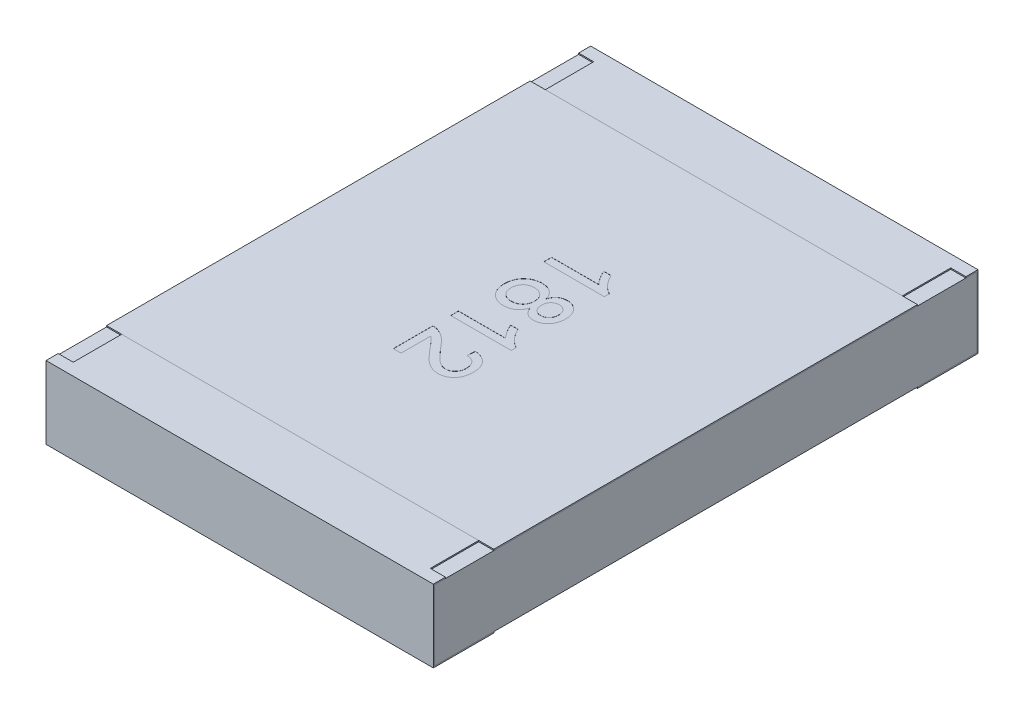
from build123d import *

# Parameters (mm, degrees)
BOSS_EXTRUDE2_DEPTH   = 1.6
BOSS_EXTRUDE2_2_DEPTH = 1.6
BOSS_EXTRUDE3_START   = -1.6
SKETCH5_W             = 4.48
SKETCH5_H             = 0.58
BOSS_EXTRUDE3_DEPTH   = 3.2
SKETCH6_W             = 0.125
SKETCH6_H             = 0.4
CUT_EXTRUDE1_DEPTH    = 0.01
SKETCH7_W             = 3.2
SKETCH7_H             = 3.5
BOSS_EXTRUDE4_DEPTH   = 0.01
TEXT1812_DEPTH        = 0.001


with BuildPart() as part:
    # Sketch4 → Boss-Extrude2 (new, symmetric)
    with BuildSketch(Plane(origin=(0, 0, 0), x_dir=(0, 0, -1), z_dir=(1, 0, 0))):
        Polygon((-2.25, 0.3), (-2.25, -0.3), (-1.75, -0.3), (-1.75, -0.29), (-2.24, -0.29), (-2.24, 0.29), (-1.75, 0.29), (-1.75, 0.3), align=None)
    extrude(amount=BOSS_EXTRUDE2_DEPTH, both=True)


with BuildPart() as body_2:
    # Sketch4 → Boss-Extrude2 2 (new, symmetric)
    with BuildSketch(Plane(origin=(0, 0, 0), x_dir=(0, 0, -1), z_dir=(1, 0, 0))):
        Polygon((1.75, 0.3), (2.25, 0.3), (2.25, -0.3), (1.75, -0.3), (1.75, -0.29), (2.24, -0.29), (2.24, 0.29), (1.75, 0.29), align=None)
    extrude(amount=BOSS_EXTRUDE2_2_DEPTH, both=True)


with BuildPart() as body_3:
    # Sketch5 → Boss-Extrude3 (new body)
    with BuildSketch(Plane(origin=(0, 0, 0), x_dir=(0, 0, -1), z_dir=(1, 0, 0)).offset(BOSS_EXTRUDE3_START)):
        Rectangle(SKETCH5_W, SKETCH5_H)
    extrude(amount=BOSS_EXTRUDE3_DEPTH)


with BuildPart() as cut_extrude1_tool:
    # Sketch6 → Cut-Extrude1 (new body)
    with BuildSketch(Plane(origin=(0, 0.3, 0), x_dir=(1, 0, 0), z_dir=(0, 1, 0))):
        with Locations((-1.5375, 1.95)):
            Rectangle(SKETCH6_W, SKETCH6_H)
        with Locations((1.5375, 1.95)):
            Rectangle(SKETCH6_W, SKETCH6_H)
        with Locations((1.5375, -1.95)):
            Rectangle(SKETCH6_W, SKETCH6_H)
        with Locations((-1.5375, -1.95)):
            Rectangle(SKETCH6_W, SKETCH6_H)
    extrude(amount=-CUT_EXTRUDE1_DEPTH)


with BuildPart() as part_1:
    add(part.part)

    # Cut-Extrude1: cut by cut_extrude1_tool
    add(cut_extrude1_tool.part, mode=Mode.SUBTRACT)


with BuildPart() as body_2_1:
    add(body_2.part)

    # Cut-Extrude1: cut by cut_extrude1_tool
    add(cut_extrude1_tool.part, mode=Mode.SUBTRACT)


with BuildPart() as body_4:
    # Sketch7 → Boss-Extrude4 (new body)
    with BuildSketch(Plane(origin=(0, 0.29, 0), x_dir=(1, 0, 0), z_dir=(0, 1, 0))):
        Rectangle(SKETCH7_W, SKETCH7_H)
    extrude(amount=BOSS_EXTRUDE4_DEPTH)

    # Sketch14 → TEXT1812 (cut)
    # profile 1 of 4: a face of its own
    with BuildSketch(Plane(origin=(0, 0.3, 0), x_dir=(1, 0, 0), z_dir=(0, 1, 0))):
        with BuildLine():
            Line((-0.25, 0.512820513), (-0.25, 0.576923077))
            Line((-0.25, 0.576923077), (0.139623397, 0.576923077))
            add(Edge.make_bspline(
                [(0.139623397, 0.576923077), (0.136064182, 0.58061432), (0.128666742, 0.588286164), (0.118190939, 0.601250264), (0.107619408, 0.615716685), (0.097315673, 0.631445442), (0.08780582, 0.647602006), (0.079128194, 0.663167946), (0.071822591, 0.677925848), (0.067824115, 0.6876443), (0.065905449, 0.692307692)],
                knots=[0, 0, 0, 0, 0.89334793, 1.85672577, 2.901900665, 4.015525414, 5.132247281, 6.168817625, 7.121308293, 8, 8, 8, 8], degree=3))
            Line((0.065905449, 0.692307692), (0.125, 0.692307692))
            add(Edge.make_bspline(
                [(0.125, 0.692307692), (0.129125269, 0.684297492), (0.137255931, 0.668509861), (0.151298701, 0.646205353), (0.166521642, 0.625381695), (0.182921383, 0.606383602), (0.199684862, 0.589353021), (0.216599871, 0.575001104), (0.233046379, 0.562992333), (0.244515995, 0.556967305), (0.25, 0.554086538)],
                knots=[0, 0, 0, 0, 1.141258006, 2.249351951, 3.335817539, 4.406819942, 5.426913362, 6.360259544, 7.215985427, 8, 8, 8, 8], degree=3))
            Line((0.25, 0.554086538), (0.25, 0.512820513))
            Line((0.25, 0.512820513), (-0.25, 0.512820513))
        make_face()
    # profile 2 of 4: a face of its own
    with BuildSketch(Plane(origin=(0, 0.3, 0), x_dir=(1, 0, 0), z_dir=(0, 1, 0))):
        with BuildLine():
            add(Edge.make_bspline(
                [(0.024238782, 0.257612179), (0.02539818, 0.260734707), (0.027670824, 0.266855463), (0.031729797, 0.27555031), (0.035977971, 0.283700759), (0.040722444, 0.291157678), (0.045841435, 0.297963565), (0.05125653, 0.30423121), (0.057051297, 0.309834993), (0.065251162, 0.316419757), (0.076469857, 0.323183919), (0.091129194, 0.329224351), (0.107150389, 0.33263727), (0.118206708, 0.333096786), (0.123898237, 0.333333333)],
                knots=[0, 0, 0, 0, 0.890222809, 1.74500863, 2.563651195, 3.346212301, 4.104991207, 4.83894661, 5.558649094, 6.25711142, 7.647231111, 9.044669077, 10.478666118, 12, 12, 12, 12], degree=3))
            add(Edge.make_bspline(
                [(0.123898237, 0.333333333), (0.128278386, 0.33322309), (0.136876757, 0.33300668), (0.149495643, 0.331144582), (0.161579073, 0.328143532), (0.17314744, 0.323945425), (0.184113889, 0.318454597), (0.194640222, 0.311930016), (0.204558084, 0.304074883), (0.213797595, 0.295071423), (0.22236411, 0.28520001), (0.229759149, 0.274364923), (0.236018114, 0.262741386), (0.241127177, 0.25035236), (0.245166426, 0.237181397), (0.247909652, 0.223181874), (0.249656619, 0.208410812), (0.249883757, 0.198289026), (0.25, 0.193108974)],
                knots=[0, 0, 0, 0, 0.994240253, 1.951724694, 2.889525738, 3.817746603, 4.740003333, 5.669832901, 6.625394318, 7.606598607, 8.595883349, 9.588474514, 10.579007712, 11.588538026, 12.627005715, 13.70202693, 14.823960705, 16, 16, 16, 16], degree=3))
            add(Edge.make_bspline(
                [(0.25, 0.193108974), (0.249882531, 0.187895942), (0.249653714, 0.177741542), (0.247930845, 0.162891635), (0.245043208, 0.14880509), (0.240946379, 0.135490203), (0.235708336, 0.122925982), (0.229270093, 0.111194985), (0.221737839, 0.10017645), (0.213021747, 0.090152007), (0.203558906, 0.081030959), (0.193421, 0.073128432), (0.18284459, 0.066350686), (0.171765423, 0.060749897), (0.160057336, 0.056606413), (0.147940915, 0.053448147), (0.135272194, 0.051616207), (0.126675148, 0.051394826), (0.122295673, 0.051282051)],
                knots=[0, 0, 0, 0, 1.171211919, 2.281388661, 3.353996503, 4.398126828, 5.406889753, 6.407389155, 7.400009931, 8.40008733, 9.387021643, 10.349004252, 11.283445052, 12.206096336, 13.131640667, 14.068727932, 15.016178647, 16, 16, 16, 16], degree=3))
            add(Edge.make_bspline(
                [(0.122295673, 0.051282051), (0.116799676, 0.051466005), (0.10602306, 0.051826703), (0.090480034, 0.055476664), (0.076018484, 0.061214569), (0.062720931, 0.069312308), (0.050803482, 0.079893012), (0.040306374, 0.092829954), (0.031199936, 0.108119802), (0.026621629, 0.119485302), (0.024238782, 0.125400641)],
                knots=[0, 0, 0, 0, 0.998577706, 1.958023041, 2.887613884, 3.820138197, 4.775709617, 5.772955836, 6.84090252, 8, 8, 8, 8], degree=3))
            add(Edge.make_bspline(
                [(0.024238782, 0.125400641), (0.022972264, 0.121667525), (0.020490437, 0.114352236), (0.015654785, 0.104016949), (0.010491973, 0.094287259), (0.004755578, 0.085171654), (-0.001623653, 0.076801098), (-0.008616028, 0.069117804), (-0.016120459, 0.062074287), (-0.024261073, 0.055779607), (-0.032853908, 0.050153458), (-0.041930308, 0.045354732), (-0.051322704, 0.041218919), (-0.061196276, 0.037924547), (-0.071409343, 0.035168652), (-0.082118687, 0.033438089), (-0.093157345, 0.032290042), (-0.100658015, 0.032131696), (-0.104467147, 0.032051282)],
                knots=[0, 0, 0, 0, 1.104291852, 2.163932927, 3.194021359, 4.191095491, 5.179477954, 6.14022076, 7.100416342, 8.060839972, 9.021354806, 9.976015018, 10.935845611, 11.894808797, 12.891399605, 13.897699827, 14.932370222, 16, 16, 16, 16], degree=3))
            add(Edge.make_bspline(
                [(-0.104467147, 0.032051282), (-0.109716763, 0.032178662), (-0.120058905, 0.032429611), (-0.135239829, 0.034634842), (-0.149823668, 0.037970706), (-0.163746516, 0.042837484), (-0.177026708, 0.04904393), (-0.189596023, 0.056746767), (-0.201582432, 0.065712197), (-0.212864831, 0.075939819), (-0.222998595, 0.087444582), (-0.232020834, 0.099798024), (-0.239541591, 0.113135515), (-0.245775203, 0.127285349), (-0.25060455, 0.142323412), (-0.253986549, 0.15822815), (-0.256000272, 0.174994886), (-0.256271764, 0.186459437), (-0.256410256, 0.192307692)],
                knots=[0, 0, 0, 0, 1.017538442, 2.004628281, 2.968924565, 3.91494067, 4.859182549, 5.806372248, 6.768514164, 7.758487756, 8.75376163, 9.736765884, 10.719748815, 11.717042441, 12.730597361, 13.777018535, 14.866020668, 16, 16, 16, 16], degree=3))
            add(Edge.make_bspline(
                [(-0.256410256, 0.192307692), (-0.256268784, 0.198155367), (-0.255991451, 0.209618779), (-0.254018827, 0.226400775), (-0.250483765, 0.242282968), (-0.24564863, 0.257300724), (-0.239586942, 0.27153775), (-0.23188486, 0.284775617), (-0.22294704, 0.297207024), (-0.212624421, 0.308545577), (-0.201347774, 0.318828416), (-0.189308416, 0.327910716), (-0.176534929, 0.335534366), (-0.163096374, 0.34182974), (-0.148943574, 0.346620754), (-0.134138206, 0.349985066), (-0.118689254, 0.352193996), (-0.108147498, 0.352438995), (-0.102764423, 0.352564103)],
                knots=[0, 0, 0, 0, 1.127132101, 2.209558585, 3.251034113, 4.258468952, 5.24716777, 6.227410442, 7.204479088, 8.19324074, 9.17723664, 10.142577905, 11.095069694, 12.039439042, 12.9979991, 13.969008511, 14.962888173, 16, 16, 16, 16], degree=3))
            add(Edge.make_bspline(
                [(-0.102764423, 0.352564103), (-0.098756291, 0.35247721), (-0.090891642, 0.352306713), (-0.079356793, 0.351263651), (-0.068361168, 0.349189532), (-0.057847876, 0.346503218), (-0.047749211, 0.343140941), (-0.03826149, 0.338800508), (-0.029246667, 0.333745833), (-0.020751206, 0.327965366), (-0.012849932, 0.321418629), (-0.005462304, 0.314322793), (0.001111121, 0.30643177), (0.007217111, 0.298045895), (0.012370618, 0.288792182), (0.017102053, 0.27902539), (0.021136528, 0.268574639), (0.023194341, 0.261302929), (0.024238782, 0.257612179)],
                knots=[0, 0, 0, 0, 1.117534471, 2.192795984, 3.224263148, 4.233356591, 5.216445495, 6.187029668, 7.137182002, 8.094962556, 9.047164155, 9.994988631, 10.946006748, 11.906812617, 12.882337995, 13.893960874, 14.931081791, 16, 16, 16, 16], degree=3))
        make_face()
        with BuildLine():
            add(Edge.make_bspline(
                [(0.123597756, 0.269230769), (0.120991462, 0.269173094), (0.115896151, 0.269060339), (0.108439177, 0.268178174), (0.101377018, 0.266534271), (0.094654968, 0.264359918), (0.088296098, 0.261507996), (0.082239417, 0.258129834), (0.07663087, 0.253979684), (0.071437279, 0.249278184), (0.066668381, 0.244061347), (0.062556899, 0.238195666), (0.059025979, 0.231791872), (0.056288833, 0.224789943), (0.053861642, 0.217368853), (0.05250548, 0.209270002), (0.051402828, 0.200684498), (0.05132298, 0.194749107), (0.051282051, 0.191706731)],
                knots=[0, 0, 0, 0, 1.043049103, 2.039163835, 2.998665249, 3.940985218, 4.862225824, 5.783757118, 6.711179319, 7.64779742, 8.584415522, 9.533532517, 10.508265797, 11.503304424, 12.538793855, 13.626426179, 14.783347844, 16, 16, 16, 16], degree=3))
            add(Edge.make_bspline(
                [(0.051282051, 0.191706731), (0.051324337, 0.188731441), (0.051406793, 0.182929788), (0.052489104, 0.174538627), (0.053924062, 0.166604499), (0.05614596, 0.159235636), (0.05889885, 0.152333799), (0.06252784, 0.146118532), (0.066452675, 0.140219913), (0.072742354, 0.133402007), (0.081592622, 0.126180682), (0.093575839, 0.119892382), (0.106731646, 0.115989795), (0.115891397, 0.115589883), (0.120592949, 0.115384615)],
                knots=[0, 0, 0, 0, 0.921921576, 1.797696591, 2.620010524, 3.419256604, 4.180591483, 4.917678108, 5.647090726, 6.372746687, 7.785892978, 9.165885261, 10.545294917, 12, 12, 12, 12], degree=3))
            add(Edge.make_bspline(
                [(0.120592949, 0.115384615), (0.125459209, 0.115631369), (0.134981221, 0.116114202), (0.148650499, 0.120013827), (0.161030782, 0.126579186), (0.170071927, 0.134079199), (0.176621705, 0.141020698), (0.180791077, 0.146959504), (0.184339581, 0.153343743), (0.187237413, 0.160197713), (0.189574544, 0.167531325), (0.191107815, 0.175364445), (0.192183151, 0.183664158), (0.192265305, 0.18936589), (0.192307692, 0.192307692)],
                knots=[0, 0, 0, 0, 1.480633456, 2.897216237, 4.289382554, 5.720567045, 6.454675042, 7.191244726, 7.924224627, 8.676083236, 9.454506446, 10.26432127, 11.104478565, 12, 12, 12, 12], degree=3))
            add(Edge.make_bspline(
                [(0.192307692, 0.192307692), (0.192266666, 0.195249815), (0.192186687, 0.200985339), (0.191079222, 0.209339269), (0.189687591, 0.21724628), (0.187456834, 0.224635404), (0.184533253, 0.231468931), (0.181018489, 0.237819439), (0.176892408, 0.243670197), (0.170652349, 0.250660118), (0.161895936, 0.258079416), (0.150029615, 0.264514985), (0.13713766, 0.268507493), (0.12816696, 0.268986691), (0.123597756, 0.269230769)],
                knots=[0, 0, 0, 0, 0.914971421, 1.783692097, 2.619276813, 3.41154606, 4.179734417, 4.928634037, 5.666713672, 6.402815618, 7.841072256, 9.212771915, 10.580332519, 12, 12, 12, 12], degree=3))
        make_face(mode=Mode.SUBTRACT)
        with BuildLine():
            add(Edge.make_bspline(
                [(-0.1015625, 0.288461538), (-0.105675937, 0.288351379), (-0.113913647, 0.288130769), (-0.126143608, 0.286173111), (-0.138176392, 0.2829054), (-0.149918479, 0.278514163), (-0.161048518, 0.272581558), (-0.170904356, 0.264644283), (-0.179338866, 0.254790377), (-0.1862755, 0.243365255), (-0.191829654, 0.230997123), (-0.195726919, 0.218128658), (-0.198263034, 0.205060946), (-0.198566293, 0.196225415), (-0.198717949, 0.191806891)],
                knots=[0, 0, 0, 0, 0.958197062, 1.91891819, 2.877746891, 3.860400281, 4.835352773, 5.803856704, 6.791304153, 7.842915719, 8.908681125, 9.942408417, 10.971027662, 12, 12, 12, 12], degree=3))
            add(Edge.make_bspline(
                [(-0.198717949, 0.191806891), (-0.198656227, 0.188163186), (-0.198536319, 0.181084505), (-0.197166117, 0.170766006), (-0.195087072, 0.161043645), (-0.192236359, 0.151872889), (-0.188336404, 0.143388689), (-0.183778167, 0.135452999), (-0.178269329, 0.128146566), (-0.171981829, 0.121473059), (-0.165028627, 0.11549446), (-0.157520547, 0.110389802), (-0.149712731, 0.105881314), (-0.141294279, 0.102425777), (-0.132494834, 0.099592707), (-0.123234593, 0.097610861), (-0.113548875, 0.096368814), (-0.106941658, 0.096226541), (-0.103565705, 0.096153846)],
                knots=[0, 0, 0, 0, 1.149459374, 2.233071888, 3.278978746, 4.285493, 5.257085958, 6.220471439, 7.168927912, 8.138117492, 9.10971045, 10.056819392, 11.000580508, 11.949856281, 12.923048194, 13.915226597, 14.934786671, 16, 16, 16, 16], degree=3))
            add(Edge.make_bspline(
                [(-0.103565705, 0.096153846), (-0.100123487, 0.096228889), (-0.093384171, 0.09637581), (-0.083485869, 0.097586711), (-0.074062616, 0.099682628), (-0.065105205, 0.1026417), (-0.05652785, 0.10619633), (-0.048457959, 0.110734553), (-0.040966071, 0.116224518), (-0.03384257, 0.122263328), (-0.027392394, 0.129092059), (-0.021830619, 0.136634478), (-0.016918505, 0.144649961), (-0.01315053, 0.153381414), (-0.010132287, 0.162636355), (-0.007939188, 0.172458786), (-0.006598604, 0.182888745), (-0.006474251, 0.190033222), (-0.006410256, 0.193709936)],
                knots=[0, 0, 0, 0, 1.065920611, 2.086902764, 3.082913842, 4.050884103, 5.005449469, 5.954622402, 6.910307362, 7.878277624, 8.843925152, 9.811840175, 10.77660138, 11.748870569, 12.74954106, 13.788175997, 14.861743805, 16, 16, 16, 16], degree=3))
            add(Edge.make_bspline(
                [(-0.006410256, 0.193709936), (-0.006474999, 0.197286756), (-0.006601914, 0.204298437), (-0.007948541, 0.214485321), (-0.010024387, 0.224126001), (-0.013025373, 0.233121393), (-0.0168655, 0.241563492), (-0.021594505, 0.249375208), (-0.027127484, 0.256668703), (-0.033541909, 0.263226621), (-0.04056438, 0.269097526), (-0.047939309, 0.274372835), (-0.055878465, 0.278674295), (-0.064156655, 0.282335286), (-0.072957178, 0.284982701), (-0.08208906, 0.287016301), (-0.091680221, 0.288243613), (-0.098220261, 0.288387835), (-0.1015625, 0.288461538)],
                knots=[0, 0, 0, 0, 1.135634247, 2.226196766, 3.258089849, 4.264262958, 5.232434119, 6.198278782, 7.159219462, 8.134279137, 9.105234738, 10.064476556, 11.009124924, 11.968659863, 12.934795644, 13.922976258, 14.938552278, 16, 16, 16, 16], degree=3))
        make_face(mode=Mode.SUBTRACT)
    # profile 3 of 4: a face of its own
    with BuildSketch(Plane(origin=(0, 0.3, 0), x_dir=(1, 0, 0), z_dir=(0, 1, 0))):
        with BuildLine():
            Line((-0.25, -0.256410256), (-0.25, -0.192307692))
            Line((-0.25, -0.192307692), (0.139623397, -0.192307692))
            add(Edge.make_bspline(
                [(0.139623397, -0.192307692), (0.136064182, -0.188616449), (0.128666742, -0.180944606), (0.118190939, -0.167980505), (0.107619408, -0.153514084), (0.097315673, -0.137785327), (0.08780582, -0.121628763), (0.079128194, -0.106062824), (0.071822591, -0.091304921), (0.067824115, -0.08158647), (0.065905449, -0.076923077)],
                knots=[0, 0, 0, 0, 0.89334793, 1.85672577, 2.901900665, 4.015525414, 5.132247281, 6.168817625, 7.121308293, 8, 8, 8, 8], degree=3))
            Line((0.065905449, -0.076923077), (0.125, -0.076923077))
            add(Edge.make_bspline(
                [(0.125, -0.076923077), (0.129125269, -0.084933277), (0.137255931, -0.100720908), (0.151298701, -0.123025416), (0.166521642, -0.143849074), (0.182921383, -0.162847168), (0.199684862, -0.179877748), (0.216599871, -0.194229665), (0.233046379, -0.206238436), (0.244515995, -0.212263464), (0.25, -0.215144231)],
                knots=[0, 0, 0, 0, 1.141258006, 2.249351951, 3.335817539, 4.406819942, 5.426913362, 6.360259544, 7.215985427, 8, 8, 8, 8], degree=3))
            Line((0.25, -0.215144231), (0.25, -0.256410256))
            Line((0.25, -0.256410256), (-0.25, -0.256410256))
        make_face()
    # profile 4 of 4: a face of its own
    with BuildSketch(Plane(origin=(0, 0.3, 0), x_dir=(1, 0, 0), z_dir=(0, 1, 0))):
        with BuildLine():
            Line((-0.185897436, -0.730769231), (-0.25, -0.730769231))
            Line((-0.25, -0.730769231), (-0.25, -0.403846154))
            add(Edge.make_bspline(
                [(-0.25, -0.403846154), (-0.246190204, -0.403839461), (-0.238583383, -0.403826097), (-0.227333376, -0.405113294), (-0.21623261, -0.407129302), (-0.209114131, -0.409408801), (-0.205528846, -0.410556891)],
                knots=[0, 0, 0, 0, 1.01057331, 2.01775941, 3.001627217, 4, 4, 4, 4], degree=3))
            add(Edge.make_bspline(
                [(-0.205528846, -0.410556891), (-0.199672194, -0.412680252), (-0.187747085, -0.417003765), (-0.170501435, -0.425729754), (-0.153461868, -0.436163988), (-0.139489569, -0.446149776), (-0.128408004, -0.455346699), (-0.11963342, -0.462930794), (-0.110764129, -0.471474124), (-0.101641984, -0.480820948), (-0.092266458, -0.490914542), (-0.082593861, -0.501754513), (-0.07280804, -0.513472978), (-0.066321448, -0.521653523), (-0.063000801, -0.525841346)],
                knots=[0, 0, 0, 0, 1.204749664, 2.453068735, 3.731868309, 5.069624937, 5.772016546, 6.5184395, 7.31363639, 8.154361805, 9.045869205, 9.979533915, 10.965673542, 12, 12, 12, 12], degree=3))
            add(Edge.make_bspline(
                [(-0.063000801, -0.525841346), (-0.057585784, -0.532274899), (-0.047158825, -0.544663113), (-0.031686185, -0.562157213), (-0.017318962, -0.578135226), (-0.003805341, -0.592342719), (0.008723604, -0.604895897), (0.020239487, -0.615824232), (0.03070637, -0.625221757), (0.040503108, -0.632973746), (0.049753955, -0.639514337), (0.058777584, -0.64505691), (0.06773162, -0.64967591), (0.076587728, -0.653522918), (0.085383783, -0.656565575), (0.094145409, -0.658639578), (0.102785672, -0.660046095), (0.108534999, -0.660186819), (0.111378205, -0.66025641)],
                knots=[0, 0, 0, 0, 1.782554561, 3.432421876, 4.950675607, 6.337395053, 7.588547463, 8.709982106, 9.702713005, 10.569305638, 11.356701089, 12.103210377, 12.812277205, 13.490692607, 14.148717897, 14.782152033, 15.397739362, 16, 16, 16, 16], degree=3))
            add(Edge.make_bspline(
                [(0.111378205, -0.66025641), (0.114188238, -0.66018681), (0.119701369, -0.660050259), (0.127769802, -0.658754665), (0.135539896, -0.656951096), (0.14287177, -0.654035271), (0.149982559, -0.650564566), (0.156647535, -0.646112537), (0.163032944, -0.640962498), (0.168969907, -0.63506597), (0.17454131, -0.62862622), (0.179166687, -0.621428301), (0.183368098, -0.613929112), (0.186646742, -0.605880802), (0.189173495, -0.597355054), (0.190933763, -0.58836554), (0.192071797, -0.578888258), (0.192227868, -0.572419219), (0.192307692, -0.569110577)],
                knots=[0, 0, 0, 0, 0.988220144, 1.938834179, 2.870816983, 3.789593262, 4.709270892, 5.651202005, 6.603702613, 7.592551374, 8.593130825, 9.593710277, 10.598146602, 11.615084639, 12.644976104, 13.72352976, 14.835681034, 16, 16, 16, 16], degree=3))
            add(Edge.make_bspline(
                [(0.192307692, -0.569110577), (0.192227732, -0.565635137), (0.192071243, -0.558833447), (0.190936175, -0.548890121), (0.189191722, -0.539454698), (0.186569692, -0.53056083), (0.183136978, -0.522226302), (0.179045534, -0.514392031), (0.174196706, -0.507087973), (0.168565002, -0.500431011), (0.162430447, -0.494264593), (0.155494268, -0.489055325), (0.148121475, -0.484501712), (0.140077995, -0.48090949), (0.131540513, -0.47797992), (0.122382293, -0.475865344), (0.11264261, -0.474709632), (0.105972365, -0.474477557), (0.102564103, -0.474358974)],
                knots=[0, 0, 0, 0, 1.131353863, 2.214142649, 3.254522363, 4.251993147, 5.226998864, 6.184887163, 7.125534989, 8.07474883, 9.020220684, 9.950764588, 10.892228595, 11.83594911, 12.812226535, 13.827427868, 14.889891388, 16, 16, 16, 16], degree=3))
            Line((0.102564103, -0.474358974), (0.108974359, -0.41025641))
            add(Edge.make_bspline(
                [(0.108974359, -0.41025641), (0.114561103, -0.410912202), (0.125429633, -0.412187987), (0.141170053, -0.415367079), (0.15581619, -0.419825528), (0.169558239, -0.425176379), (0.182228095, -0.431835316), (0.193871977, -0.439555079), (0.20454309, -0.448329649), (0.213993267, -0.458311826), (0.222618938, -0.469119547), (0.229876147, -0.481020913), (0.236164414, -0.49373983), (0.241249058, -0.507366821), (0.245145041, -0.521896537), (0.247930691, -0.537306349), (0.249649875, -0.5536137), (0.249881626, -0.564799406), (0.25, -0.570512821)],
                knots=[0, 0, 0, 0, 1.130902199, 2.200072888, 3.223843306, 4.206271996, 5.161246612, 6.096017809, 7.01151883, 7.932713564, 8.85544837, 9.78703152, 10.729845199, 11.705020675, 12.706647005, 13.750927778, 14.851223069, 16, 16, 16, 16], degree=3))
            add(Edge.make_bspline(
                [(0.25, -0.570512821), (0.24990096, -0.576294577), (0.249708029, -0.587557473), (0.247735103, -0.603969625), (0.244659885, -0.619453813), (0.240382222, -0.634072011), (0.234732773, -0.647746554), (0.227928529, -0.660524261), (0.219852523, -0.672364674), (0.210540088, -0.683107051), (0.200369372, -0.692794416), (0.189509921, -0.701271504), (0.178049555, -0.708398294), (0.166021375, -0.714293127), (0.153347568, -0.718806854), (0.140075652, -0.721948101), (0.126237909, -0.72409235), (0.116795268, -0.724268918), (0.111979167, -0.724358974)],
                knots=[0, 0, 0, 0, 1.195163465, 2.32818547, 3.412777349, 4.456995471, 5.472468761, 6.467096601, 7.445683341, 8.429710765, 9.401551923, 10.346206623, 11.27346832, 12.187474603, 13.111233882, 14.049000595, 15.004916959, 16, 16, 16, 16], degree=3))
            add(Edge.make_bspline(
                [(0.111979167, -0.724358974), (0.107030663, -0.724223785), (0.097122734, -0.723953109), (0.082332055, -0.721760983), (0.067657262, -0.718232324), (0.052981733, -0.713336041), (0.038292684, -0.706521965), (0.023237391, -0.698129891), (0.007927337, -0.687640939), (-0.005185376, -0.677693855), (-0.016100688, -0.668328415), (-0.025104319, -0.660027076), (-0.034707985, -0.650425279), (-0.045099702, -0.63977836), (-0.056125829, -0.627868251), (-0.067952516, -0.614911987), (-0.080329296, -0.600652232), (-0.088782578, -0.590751266), (-0.093149038, -0.585637019)],
                knots=[0, 0, 0, 0, 0.927016037, 1.85607784, 2.795426669, 3.753038224, 4.749807569, 5.825438141, 6.979408615, 8.224540393, 8.907917664, 9.673913905, 10.518929318, 11.452509573, 12.461825982, 13.560287397, 14.739790317, 16, 16, 16, 16], degree=3))
            add(Edge.make_bspline(
                [(-0.093149038, -0.585637019), (-0.096714295, -0.581257523), (-0.103512691, -0.572906499), (-0.113369606, -0.5610265), (-0.122404327, -0.55038235), (-0.1303383, -0.540739291), (-0.137487823, -0.53242406), (-0.143708014, -0.525258308), (-0.149086369, -0.519313189), (-0.157337473, -0.510250158), (-0.169000351, -0.498684043), (-0.180421993, -0.490230463), (-0.185897436, -0.486177885)],
                knots=[0, 0, 0, 0, 1.24205232, 2.36840259, 3.395101816, 4.312728136, 5.114777656, 5.806942724, 6.399692637, 6.87784234, 8.503262741, 10, 10, 10, 10], degree=3))
            Line((-0.185897436, -0.486177885), (-0.185897436, -0.730769231))
        make_face()
    extrude(amount=-TEXT1812_DEPTH, mode=Mode.SUBTRACT)


solid = Compound([body_3.part, part_1.part, body_2_1.part, body_4.part])
